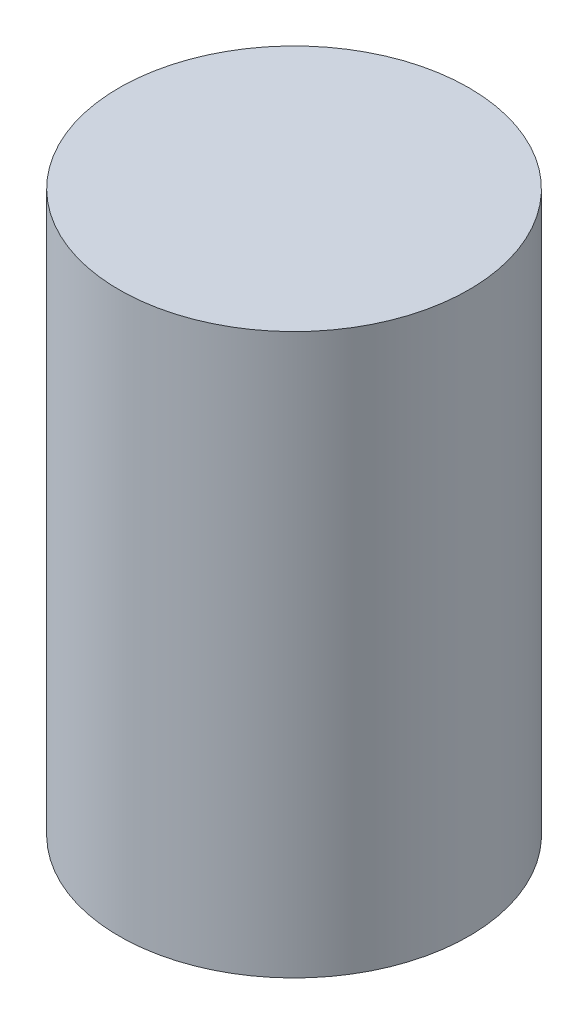
from build123d import *


with BuildPart() as part:
    # Esquisse1 → Révolution1 (revolve)
    with BuildSketch(Plane.XY, mode=Mode.PRIVATE) as r_volution1_sk:
        Polygon((0, -7.945652174), (0, -6.945652174), (0, 12.054347826), (0, 32.054347826), (-12.5, 32.054347826), (-12.5, 31.054347826), (-12.5, -6.945652174), (-12.5, -7.945652174), align=None)
    revolve(r_volution1_sk.sketch.rotate(Axis((0, -27.01473029, 0), (0, 1, 0)), 270), axis=Axis((0, -27.01473029, 0), (0, 1, 0)))


solid = part.part
